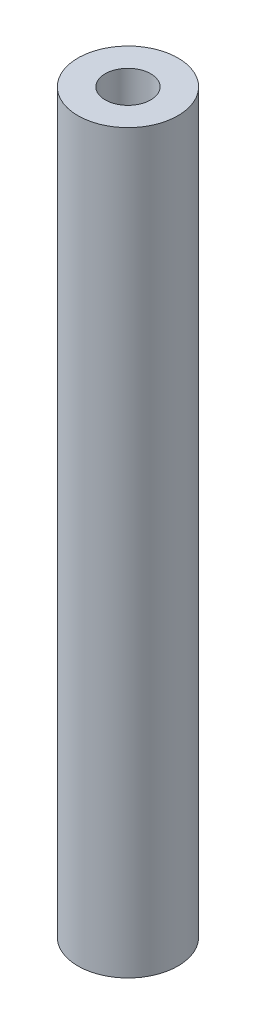
from build123d import *

# Parameters (mm, degrees)
SKETCH1_R           = 5.5
SKETCH1_R_2         = 2.5
BOSS_EXTRUDE1_DEPTH = 81


with BuildPart() as part:
    # Sketch1 → Boss-Extrude1 (new body)
    with BuildSketch(Plane(origin=(0, 0, 0), x_dir=(1, 0, 0), z_dir=(0, 1, 0))):
        with Locations(Location((0, 0, 0), (0, 0, 270))):
            Circle(SKETCH1_R)
        with Locations(Location((0, 0, 0), (0, 0, 270))):
            Circle(SKETCH1_R_2, mode=Mode.SUBTRACT)
    extrude(amount=BOSS_EXTRUDE1_DEPTH)


solid = part.part
